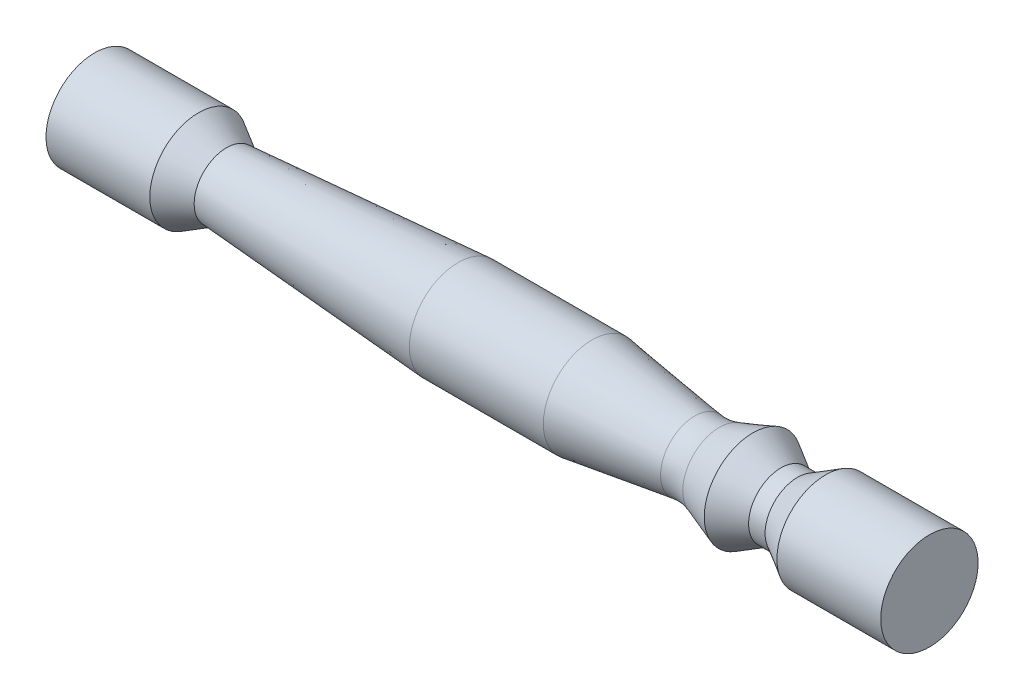
from build123d import *

# Parameters (mm, degrees)
FILLET1_R = 5.08


with BuildPart() as part:
    # Sketch1 → Revolve1 (revolve)
    with BuildSketch(Plane.XY, mode=Mode.PRIVATE) as revolve1_sk:
        Polygon((-40.8432, 0), (40.8432, 0), (40.8432, 4.7625), (30.6832, 4.7625), (27.933569343, 3.175), (26.320830657, 3.175), (23.5712, 4.7625), (19.118849434, 3.175), (7.8232, 4.7625), (-5.2832, 4.7625), (-27.933569343, 3.175), (-30.6832, 4.7625), (-40.8432, 4.7625), align=None)
    revolve(revolve1_sk.sketch.rotate(Axis((-40.8432, 0, 0), (1, 0, 0)), 90), axis=Axis((-40.8432, 0, 0), (1, 0, 0)))

    # Fillet1
    fillet1_edges = [part.edges().sort_by_distance(p)[0] for p in [
        (19.118849434, 0, -3.175),
    ]]
    fillet(fillet1_edges, radius=FILLET1_R)


solid = part.part
